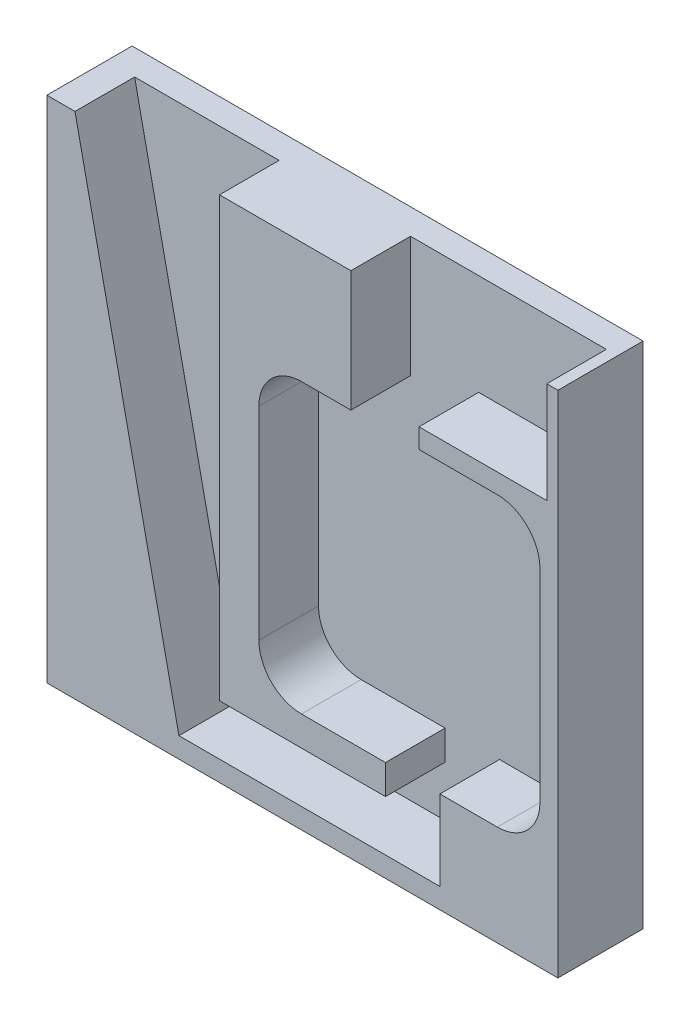
from build123d import *

# Parameters (mm, degrees)
BOSS_EXTRUDE1_DEPTH = 10
CUT_EXTRUDE1_DEPTH  = 7
SKETCH3_W           = 15
SKETCH3_H           = 11.874964638
CUT_EXTRUDE2_DEPTH  = 7
CUT_EXTRUDE3_DEPTH  = 7


with BuildPart() as part:
    # Sketch1 → Boss-Extrude1 (new body)
    with BuildSketch(Plane.XY):
        Polygon((-28.187365871, 32.751649119), (21.812634129, 32.751649119), (21.812634129, -27.017852667), (-28.187365871, -27.017852667), (-38.187365871, -27.017852667), (-38.187365871, 32.751649119), align=None)
    extrude(amount=BOSS_EXTRUDE1_DEPTH)

    # Sketch2 → Cut-Extrude1 (cut)
    with BuildSketch(Plane.XY.offset(10)):
        with BuildLine():
            Line((-8.298420819, 18.570619113), (14.701579181, 18.570619113))
            ThreePointArc((14.701579181, 18.570619113), (18.237113087, 17.106153019), (19.701579181, 13.570619113))
            Line((19.701579181, 13.570619113), (19.701579181, -10.229380887))
            ThreePointArc((19.701579181, -10.229380887), (18.237113087, -13.764914793), (14.701579181, -15.229380887))
            Line((14.701579181, -15.229380887), (-8.298420819, -15.229380887))
            ThreePointArc((-8.298420819, -15.229380887), (-11.833954725, -13.764914793), (-13.298420819, -10.229380887))
            Line((-13.298420819, -10.229380887), (-13.298420819, 13.570619113))
            ThreePointArc((-13.298420819, 13.570619113), (-11.833954725, 17.106153019), (-8.298420819, 18.570619113))
        make_face()
    extrude(amount=-CUT_EXTRUDE1_DEPTH, mode=Mode.SUBTRACT)

    # Sketch3 → Cut-Extrude2 (cut)
    with BuildSketch(Plane.XY.offset(10)):
        Polygon((5.503263718, 32.751649119), (-2.496736282, 32.751649119), (-2.496736282, 18.570619113), (5.503263718, 18.570619113), (5.503263718, 20.876684481), align=None)
        with Locations((13.003263718, 26.8141668)):
            Rectangle(SKETCH3_W, SKETCH3_H)
    extrude(amount=-CUT_EXTRUDE2_DEPTH, mode=Mode.SUBTRACT)

    # Sketch4 → Cut-Extrude3 (cut)
    with BuildSketch(Plane.XY.offset(10)):
        Polygon((1.563165921, -15.229380887), (7.956099034, -15.229380887), (7.956099034, -24.630130661), (1.563165921, -24.630130661), (-17.923726581, -24.630130661), (-22.688843527, -24.630130661), (-34.888499332, 32.751649119), (-17.923726581, 32.751649119), (-17.923726581, -18.699337291), (1.563165921, -18.699337291), align=None)
    extrude(amount=-CUT_EXTRUDE3_DEPTH, mode=Mode.SUBTRACT)


solid = part.part
